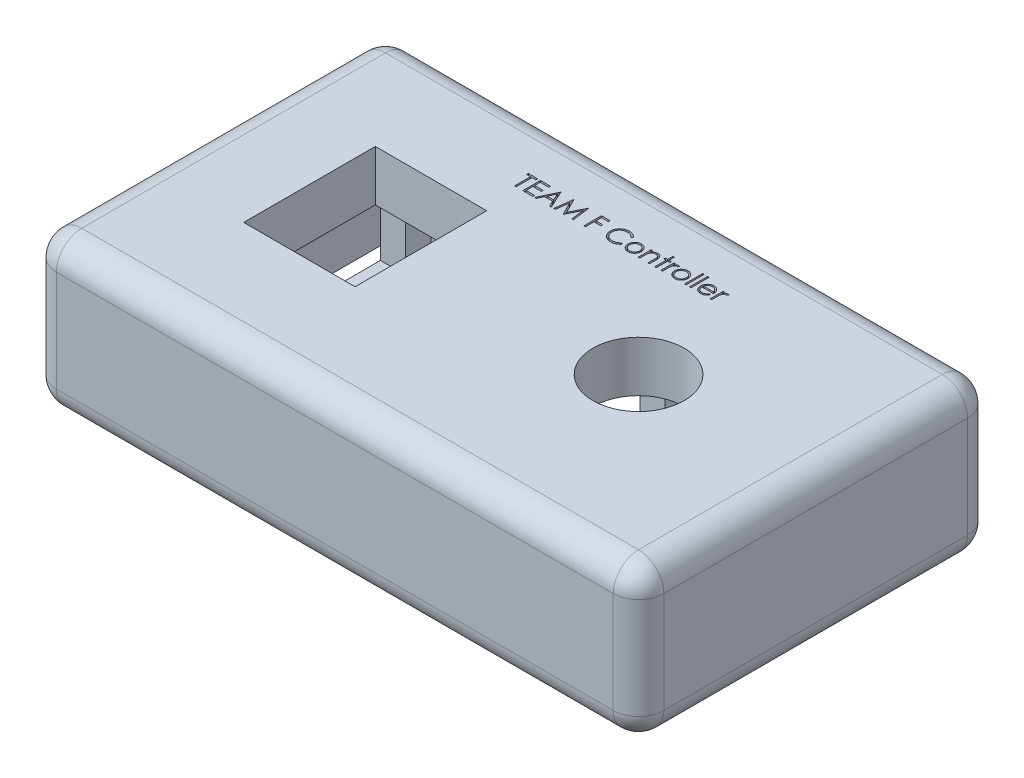
from build123d import *

# Parameters (mm, degrees)
SKETCH1_W           = 120
SKETCH1_H           = 70
BOSS_EXTRUDE1_DEPTH = 30
SKETCH2_R           = 9
SKETCH2_W           = 22
SKETCH2_H           = 26
CUT_EXTRUDE1_DEPTH  = 76.663729752
SKETCH4_W           = 21
SKETCH4_H           = 13
CUT_EXTRUDE3_DEPTH  = 10
SKETCH6_W           = 105
SKETCH6_H           = 55
CUT_EXTRUDE4_DEPTH  = 20
SKETCH8_W           = 5
SKETCH8_H           = 5
BOSS_EXTRUDE2_DEPTH = 10
SKETCH9_W           = 20
SKETCH9_H           = 30
SKETCH9_W_2         = 22
SKETCH9_H_2         = 38
BOSS_EXTRUDE3_DEPTH = 2.5
SKETCH11_W          = 10
SKETCH11_H          = 11.5
CUT_EXTRUDE5_DEPTH  = 5
SKETCH12_W          = 0.314102564
SKETCH12_H          = 3.58974359
SKETCH12_W_2        = 0.314102565
CUT_EXTRUDE6_DEPTH  = 1
FILLET1_R           = 5
CUT_EXTRUDE7_REACH  = 98.954
SKETCH14_W          = 15
SKETCH14_H          = 7.5
FILLET2_R           = 2


with BuildPart() as part:
    # Sketch1 → Boss-Extrude1 (new body)
    with BuildSketch(Plane(origin=(0, 0, 0), x_dir=(1, 0, 0), z_dir=(0, 1, 0))):
        Rectangle(SKETCH1_W, SKETCH1_H)
    extrude(amount=BOSS_EXTRUDE1_DEPTH)

    # Sketch2 → Cut-Extrude1 (cut, through all)
    with BuildSketch(Plane(origin=(0, 30, 0), x_dir=(1, 0, 0), z_dir=(0, 1, 0))):
        with Locations(Location((25, 0, 0), (0, 0, 270))):
            Circle(SKETCH2_R)
        with Locations((-29, 0)):
            Rectangle(SKETCH2_W, SKETCH2_H)
    extrude(amount=-CUT_EXTRUDE1_DEPTH, mode=Mode.SUBTRACT)

    # Sketch4 → Cut-Extrude3 (cut)
    with BuildSketch(Plane(origin=(0, 0, -35), x_dir=(-1, 0, 0), z_dir=(0, 0, -1))):
        with Locations((-39.5, 15)):
            Rectangle(SKETCH4_W, SKETCH4_H)
        with Locations((39.5, 15)):
            Rectangle(SKETCH4_W, SKETCH4_H)
    extrude(amount=-CUT_EXTRUDE3_DEPTH, mode=Mode.SUBTRACT)

    # Sketch6 → Cut-Extrude4 (cut)
    with BuildSketch(Plane.XZ):
        Rectangle(SKETCH6_W, SKETCH6_H)
    extrude(amount=-CUT_EXTRUDE4_DEPTH, mode=Mode.SUBTRACT)

    # Sketch8 → Boss-Extrude2 (add)
    with BuildSketch(Plane.XZ.offset(-20)):
        with Locations((32.5, -12.75)):
            Rectangle(SKETCH8_W, SKETCH8_H)
        with Locations((32.5, 12.25)):
            Rectangle(SKETCH8_W, SKETCH8_H)
        with Locations((17.5, 12.25)):
            Rectangle(SKETCH8_W, SKETCH8_H)
        with Locations((17.5, -12.75)):
            Rectangle(SKETCH8_W, SKETCH8_H)
        with Locations((-20.5, -16.5)):
            Rectangle(SKETCH8_W, SKETCH8_H)
        with Locations((-20.5, 16.5)):
            Rectangle(SKETCH8_W, SKETCH8_H)
        with Locations((-37.5, 16.5)):
            Rectangle(SKETCH8_W, SKETCH8_H)
        with Locations((-37.5, -16.5)):
            Rectangle(SKETCH8_W, SKETCH8_H)
    extrude(amount=BOSS_EXTRUDE2_DEPTH)

    # Sketch9 → Boss-Extrude3 (add)
    with BuildSketch(Plane(origin=(0, 10, 0), x_dir=(-1, 0, 0), z_dir=(0, -1, 0))):
        with Locations((-25, 0.25)):
            Rectangle(SKETCH9_W, SKETCH9_H)
        with Locations((29, 0)):
            Rectangle(SKETCH9_W_2, SKETCH9_H_2)
    extrude(amount=BOSS_EXTRUDE3_DEPTH)

    # Sketch11 → Cut-Extrude5 (cut)
    with BuildSketch(Plane.XY.offset(-27.5)):
        with Locations((-24, 14.25)):
            Rectangle(SKETCH11_W, SKETCH11_H)
        with Locations((24, 14.25)):
            Rectangle(SKETCH11_W, SKETCH11_H)
    extrude(amount=-CUT_EXTRUDE5_DEPTH, mode=Mode.SUBTRACT)

    # Sketch12 → Cut-Extrude6 (cut)
    # profile 1 of 15: a face of its own
    with BuildSketch(Plane(origin=(0, 30, 0), x_dir=(1, 0, 0), z_dir=(0, 1, 0))):
        Polygon((-20.259615385, 23.141025641), (-20.259615385, 23.5), (-18.419871795, 23.5), (-18.419871795, 23.141025641), (-19.182692308, 23.141025641), (-19.182692308, 20), (-19.496794872, 20), (-19.496794872, 23.141025641), align=None)
    # profile 2 of 15: a face of its own
    with BuildSketch(Plane(origin=(0, 30, 0), x_dir=(1, 0, 0), z_dir=(0, 1, 0))):
        Polygon((-17.881410256, 23.5), (-15.907051282, 23.5), (-15.907051282, 23.141025641), (-17.567307692, 23.141025641), (-17.567307692, 22.064102564), (-15.907051282, 22.064102564), (-15.907051282, 21.705128205), (-17.567307692, 21.705128205), (-17.567307692, 20.358974359), (-15.907051282, 20.358974359), (-15.907051282, 20), (-17.881410256, 20), align=None)
    # profile 3 of 15: a face of its own
    with BuildSketch(Plane(origin=(0, 30, 0), x_dir=(1, 0, 0), z_dir=(0, 1, 0))):
        Polygon((-13.842948718, 23.5), (-12.227564103, 20), (-12.569010417, 20), (-13.086438301, 21.121794872), (-14.673076923, 21.121794872), (-15.205228365, 20), (-15.548076923, 20), (-13.887820513, 23.5), align=None)
        Polygon((-13.868890224, 22.817808494), (-14.502704327, 21.480769231), (-13.251903045, 21.480769231), align=None, mode=Mode.SUBTRACT)
    # profile 4 of 15: a face of its own
    with BuildSketch(Plane(origin=(0, 30, 0), x_dir=(1, 0, 0), z_dir=(0, 1, 0))):
        Polygon((-11.778846154, 20), (-11.316806891, 23.5), (-11.271935096, 23.5), (-9.826923077, 20.628205128), (-8.385416667, 23.5), (-8.33984375, 23.5), (-7.875, 20), (-8.190504808, 20), (-8.525641026, 22.518429487), (-9.7890625, 20), (-9.859875801, 20), (-11.128205128, 22.524038462), (-11.462640224, 20), align=None)
    # profile 5 of 15: a face of its own
    with BuildSketch(Plane(origin=(0, 30, 0), x_dir=(1, 0, 0), z_dir=(0, 1, 0))):
        Polygon((-5.810897436, 23.5), (-4.105769231, 23.5), (-4.105769231, 23.141025641), (-5.496794872, 23.141025641), (-5.496794872, 22.064102564), (-4.105769231, 22.064102564), (-4.105769231, 21.705128205), (-5.496794872, 21.705128205), (-5.496794872, 20), (-5.810897436, 20), align=None)
    # profile 6 of 15: a face of its own
    with BuildSketch(Plane(origin=(0, 30, 0), x_dir=(1, 0, 0), z_dir=(0, 1, 0))):
        with BuildLine():
            Line((1.099358974, 22.857772436), (0.824519231, 22.647435897))
            add(Edge.make_bspline(
                [(0.824519231, 22.647435897), (0.804913342, 22.670801867), (0.765965896, 22.717218783), (0.703306693, 22.782398327), (0.63800505, 22.843463589), (0.570085929, 22.900705469), (0.498326809, 22.952122234), (0.424466011, 23.000393337), (0.347267966, 23.043661075), (0.240516231, 23.096124061), (0.100868383, 23.150870216), (-0.074926456, 23.196773448), (-0.258437555, 23.225994623), (-0.383635155, 23.229159465), (-0.447315705, 23.230769231)],
                knots=[0, 0, 0, 0, 0.757959112, 1.505699292, 2.245454638, 2.979532153, 3.711538275, 4.438200793, 5.171680507, 5.909471876, 7.393775596, 8.890124382, 10.418191784, 12, 12, 12, 12], degree=3))
            add(Edge.make_bspline(
                [(-0.447315705, 23.230769231), (-0.482399004, 23.230365268), (-0.552239997, 23.229561092), (-0.655888471, 23.218951967), (-0.757601522, 23.204040757), (-0.857312988, 23.181915434), (-0.954895946, 23.153942815), (-1.050988348, 23.120517401), (-1.144198948, 23.079162561), (-1.235817187, 23.033454301), (-1.323596398, 22.981826856), (-1.406651445, 22.925513504), (-1.484679413, 22.865144408), (-1.557742025, 22.800493302), (-1.625913974, 22.731851341), (-1.688701284, 22.658487), (-1.745886695, 22.580634826), (-1.79860372, 22.499321419), (-1.845816453, 22.414783627), (-1.885346333, 22.326708556), (-1.920351455, 22.236604453), (-1.948050697, 22.143453293), (-1.969975214, 22.047910527), (-1.985102878, 21.949719739), (-1.995591349, 21.849086059), (-1.996391526, 21.780876747), (-1.996794872, 21.746494391)],
                knots=[0, 0, 0, 0, 1.054917814, 2.100044995, 3.131103042, 4.146048494, 5.169673617, 6.183595914, 7.203665975, 8.234915748, 9.262203917, 10.264457458, 11.251630812, 12.227803204, 13.197192746, 14.159520551, 15.12972552, 16.100847026, 17.073214652, 18.039054194, 19.002613845, 19.979014051, 20.95965708, 21.949030935, 22.966165397, 24, 24, 24, 24], degree=3))
            add(Edge.make_bspline(
                [(-1.996794872, 21.746494391), (-1.995533053, 21.694763071), (-1.993055638, 21.593195486), (-1.971007304, 21.444424876), (-1.937502213, 21.301904202), (-1.887286636, 21.16652436), (-1.825367586, 21.036616002), (-1.747126974, 20.914377148), (-1.656510437, 20.797960584), (-1.552236017, 20.690117636), (-1.437830201, 20.591603911), (-1.31508229, 20.504853329), (-1.184298002, 20.432538447), (-1.046921372, 20.3723625), (-0.901895258, 20.326105772), (-0.749480455, 20.293541649), (-0.59000846, 20.272299468), (-0.48103906, 20.27026578), (-0.425580929, 20.269230769)],
                knots=[0, 0, 0, 0, 1.029171465, 2.020641659, 2.987623507, 3.938342917, 4.889210282, 5.84687017, 6.821220943, 7.821438502, 8.827599549, 9.822697543, 10.807740252, 11.797342354, 12.80366471, 13.83203677, 14.896651826, 16, 16, 16, 16], degree=3))
            add(Edge.make_bspline(
                [(-0.425580929, 20.269230769), (-0.36447824, 20.270919549), (-0.244213532, 20.274243472), (-0.067845505, 20.302402721), (0.10099026, 20.348060638), (0.262302847, 20.411958561), (0.415637493, 20.495023849), (0.561234153, 20.595721726), (0.699215724, 20.715010059), (0.782187006, 20.806093187), (0.824519231, 20.852564103)],
                knots=[0, 0, 0, 0, 1.028121516, 2.023589091, 2.998037872, 3.967518031, 4.937445131, 5.927275754, 6.942489185, 8, 8, 8, 8], degree=3))
            Line((0.824519231, 20.852564103), (1.099358974, 20.644330929))
            add(Edge.make_bspline(
                [(1.099358974, 20.644330929), (1.077240864, 20.615792478), (1.033110589, 20.558852271), (0.961652572, 20.478580562), (0.886375275, 20.403076526), (0.806719565, 20.332948905), (0.723601773, 20.266794439), (0.635529461, 20.206492608), (0.543660428, 20.151201724), (0.448305949, 20.100574799), (0.349567337, 20.055657552), (0.247562902, 20.017203784), (0.142732326, 19.984078895), (0.035070818, 19.956826958), (-0.075644939, 19.935555874), (-0.189015413, 19.921336199), (-0.305285288, 19.911594285), (-0.383726709, 19.910706369), (-0.423477564, 19.91025641)],
                knots=[0, 0, 0, 0, 0.986787822, 1.968848986, 2.935600012, 3.899624008, 4.868462664, 5.837806735, 6.815139263, 7.798259679, 8.787526145, 9.778297419, 10.776456485, 11.791383307, 12.812564526, 13.85620153, 14.913611965, 16, 16, 16, 16], degree=3))
            add(Edge.make_bspline(
                [(-0.423477564, 19.91025641), (-0.461121231, 19.910518403), (-0.535556921, 19.911036461), (-0.645455673, 19.919428628), (-0.752445254, 19.930878365), (-0.85621988, 19.948118496), (-0.957345855, 19.968462836), (-1.054906439, 19.995734093), (-1.149861649, 20.026283259), (-1.24182999, 20.062188246), (-1.33088969, 20.102704429), (-1.416753501, 20.148495987), (-1.499381934, 20.199177852), (-1.579587355, 20.253632863), (-1.656184938, 20.313610164), (-1.729838464, 20.378276799), (-1.80096094, 20.44741481), (-1.844963625, 20.497269663), (-1.86708734, 20.522335737)],
                knots=[0, 0, 0, 0, 1.114604814, 2.203992996, 3.262667896, 4.300477797, 5.318619304, 6.316056647, 7.298880507, 8.271930387, 9.238335007, 10.195173496, 11.151986948, 12.108099108, 13.064862484, 14.031167946, 15.010108607, 16, 16, 16, 16], degree=3))
            add(Edge.make_bspline(
                [(-1.86708734, 20.522335737), (-1.902522983, 20.565876926), (-1.97296646, 20.652433637), (-2.063092144, 20.792719618), (-2.140239699, 20.939187827), (-2.20261562, 21.092607755), (-2.251378353, 21.252635143), (-2.285159548, 21.419350657), (-2.307111152, 21.592598599), (-2.309621441, 21.710435388), (-2.310897436, 21.770332532)],
                knots=[0, 0, 0, 0, 0.994628077, 1.977248131, 2.950237994, 3.925870899, 4.908910175, 5.911660606, 6.938484602, 8, 8, 8, 8], degree=3))
            add(Edge.make_bspline(
                [(-2.310897436, 21.770332532), (-2.309342242, 21.833287986), (-2.306282496, 21.95714891), (-2.280286701, 22.138922863), (-2.238467904, 22.313074262), (-2.179071016, 22.479278007), (-2.103765665, 22.638408287), (-2.010739051, 22.789249492), (-1.901071908, 22.932766292), (-1.775624341, 23.066781043), (-1.638057005, 23.189320396), (-1.490738192, 23.297126599), (-1.333956245, 23.386844115), (-1.169438393, 23.461840278), (-0.995952711, 23.519484741), (-0.813869342, 23.559837928), (-0.623530427, 23.584955044), (-0.493668002, 23.588130252), (-0.427684295, 23.58974359)],
                knots=[0, 0, 0, 0, 1.032925535, 2.032216505, 3.007276963, 3.968222605, 4.92396291, 5.891752235, 6.871517503, 7.883894988, 8.900124299, 9.891468569, 10.874487609, 11.85992873, 12.854644235, 13.869047385, 14.917252991, 16, 16, 16, 16], degree=3))
            add(Edge.make_bspline(
                [(-0.427684295, 23.58974359), (-0.387469823, 23.589261452), (-0.307869326, 23.588307108), (-0.190116673, 23.579000965), (-0.075474346, 23.563487359), (0.036136636, 23.542371289), (0.145259252, 23.516163968), (0.251059493, 23.48202367), (0.35415818, 23.442987138), (0.453905088, 23.398028672), (0.549821638, 23.347561931), (0.641877957, 23.292146307), (0.729342815, 23.231850502), (0.812831664, 23.167187326), (0.890947875, 23.096788767), (0.965909353, 23.022591171), (1.035170431, 22.942457347), (1.077923626, 22.886052413), (1.099358974, 22.857772436)],
                knots=[0, 0, 0, 0, 1.096760587, 2.17092713, 3.219439832, 4.250915756, 5.268269357, 6.278326846, 7.281116186, 8.274029601, 9.260640565, 10.235837813, 11.203064059, 12.156899882, 13.114053108, 14.069676657, 15.032185724, 16, 16, 16, 16], degree=3))
        make_face()
    # profile 7 of 15: a face of its own
    with BuildSketch(Plane(origin=(0, 30, 0), x_dir=(1, 0, 0), z_dir=(0, 1, 0))):
        with BuildLine():
            add(Edge.make_bspline(
                [(2.962940705, 22.602564103), (3.010931978, 22.601542211), (3.105031136, 22.599538533), (3.242839021, 22.578123567), (3.374384157, 22.545376203), (3.50017035, 22.500104641), (3.618586645, 22.43942269), (3.731357889, 22.367013399), (3.838174898, 22.281230805), (3.902197927, 22.214872737), (3.934695513, 22.181189904)],
                knots=[0, 0, 0, 0, 1.054011418, 2.066658804, 3.057071809, 4.030435133, 4.997543892, 5.974964718, 6.972108034, 8, 8, 8, 8], degree=3))
            add(Edge.make_bspline(
                [(3.934695513, 22.181189904), (3.962677467, 22.148975918), (4.018099847, 22.085171376), (4.089165566, 21.981715763), (4.150387126, 21.874575662), (4.199450087, 21.762328336), (4.238135111, 21.645953664), (4.265600807, 21.525051653), (4.281937742, 21.399889306), (4.284140709, 21.314885468), (4.28525641, 21.271834936)],
                knots=[0, 0, 0, 0, 1.025258237, 2.030674902, 3.01204498, 3.988269485, 4.97094183, 5.956517959, 6.965070386, 8, 8, 8, 8], degree=3))
            add(Edge.make_bspline(
                [(4.28525641, 21.271834936), (4.284275073, 21.228534878), (4.282335905, 21.142971945), (4.263992288, 21.016952579), (4.235461202, 20.894757756), (4.194629364, 20.776899063), (4.142271255, 20.663016235), (4.078380567, 20.553606686), (4.00250895, 20.448454553), (3.916504953, 20.348452714), (3.821453077, 20.2562865), (3.718336929, 20.17595823), (3.609182895, 20.107136706), (3.492539542, 20.05170029), (3.369472055, 20.00799059), (3.239714987, 19.977290573), (3.103469917, 19.95872889), (3.010442695, 19.956345316), (2.962940705, 19.955128205)],
                knots=[0, 0, 0, 0, 0.998656419, 1.973391657, 2.932242238, 3.890759089, 4.846373663, 5.82037756, 6.809684879, 7.83454468, 8.860553229, 9.859544525, 10.845671541, 11.83227036, 12.833544569, 13.85385346, 14.904124723, 16, 16, 16, 16], degree=3))
            add(Edge.make_bspline(
                [(2.962940705, 19.955128205), (2.915205986, 19.956349401), (2.821715126, 19.958741176), (2.684989144, 19.977218459), (2.554999525, 20.007976441), (2.431770927, 20.051843934), (2.31462608, 20.107138478), (2.204839583, 20.175750167), (2.101639667, 20.256310322), (2.006567683, 20.348446259), (1.920569077, 20.448456216), (1.844696069, 20.553606254), (1.780805743, 20.663016348), (1.728447539, 20.776899033), (1.687615726, 20.894757764), (1.659084633, 21.016952577), (1.640741019, 21.142971945), (1.63880185, 21.228534878), (1.637820513, 21.271834936)],
                knots=[0, 0, 0, 0, 1.099876186, 2.154163076, 3.173186993, 4.173200201, 5.163417411, 6.152872554, 7.150605724, 8.17532212, 9.198891216, 10.186952605, 11.159729845, 12.11414092, 13.071450619, 14.029093627, 15.002601286, 16, 16, 16, 16], degree=3))
            add(Edge.make_bspline(
                [(1.637820513, 21.271834936), (1.638943823, 21.314651482), (1.641167785, 21.399420884), (1.657488294, 21.524347945), (1.68484685, 21.645045334), (1.723578247, 21.76097081), (1.773093438, 21.872726246), (1.833454725, 21.980131077), (1.905245358, 22.083118877), (1.96044731, 22.146840957), (1.98838141, 22.179086538)],
                knots=[0, 0, 0, 0, 1.031353054, 2.041901799, 3.029428768, 4.008703097, 4.981709435, 5.96992636, 6.972712378, 8, 8, 8, 8], degree=3))
            add(Edge.make_bspline(
                [(1.98838141, 22.179086538), (2.020830001, 22.213061478), (2.084645865, 22.279879174), (2.191994593, 22.365411698), (2.304488414, 22.439327772), (2.42421334, 22.498803987), (2.549896198, 22.545642505), (2.682115441, 22.57820802), (2.820390956, 22.599461375), (2.914950577, 22.601519553), (2.962940705, 22.602564103)],
                knots=[0, 0, 0, 0, 1.027980169, 2.021703884, 2.998553061, 3.971491411, 4.943284454, 5.930300938, 6.949603206, 8, 8, 8, 8], degree=3))
        make_face()
        with BuildLine():
            add(Edge.make_bspline(
                [(2.961538462, 22.288461538), (2.92760085, 22.287496947), (2.860601722, 22.285592664), (2.761982137, 22.27110876), (2.667041983, 22.248161255), (2.575601139, 22.215557199), (2.487967966, 22.1734583), (2.404058564, 22.12174994), (2.323626124, 22.061116984), (2.248244061, 21.991654312), (2.179061749, 21.915775317), (2.118583772, 21.834926959), (2.067158666, 21.750420612), (2.024318507, 21.662168401), (1.992411319, 21.569275987), (1.969238296, 21.472795356), (1.954768056, 21.37252994), (1.952881677, 21.304368921), (1.951923077, 21.269731571)],
                knots=[0, 0, 0, 0, 1.021534396, 2.016698045, 2.994645724, 3.958388632, 4.93408049, 5.916473867, 6.921342795, 7.962252576, 8.998418191, 10.008913653, 10.997312074, 11.973003931, 12.956656626, 13.948281152, 14.957379055, 16, 16, 16, 16], degree=3))
            add(Edge.make_bspline(
                [(1.951923077, 21.269731571), (1.953529901, 21.224979543), (1.956719145, 21.136155138), (1.982654381, 21.005344015), (2.026040661, 20.879762163), (2.084627941, 20.760145777), (2.15803416, 20.649473499), (2.244521226, 20.550802015), (2.343160927, 20.465616203), (2.452777427, 20.394935358), (2.571131745, 20.338775602), (2.696388066, 20.298976626), (2.82702876, 20.273104934), (2.916309491, 20.270533459), (2.961538462, 20.269230769)],
                knots=[0, 0, 0, 0, 1.016792936, 2.018143844, 3.017858371, 4.030088057, 5.03801393, 6.028138512, 7.003788237, 7.991172063, 8.984598303, 9.972568034, 10.972917682, 12, 12, 12, 12], degree=3))
            add(Edge.make_bspline(
                [(2.961538462, 20.269230769), (3.00676483, 20.270541049), (3.096040426, 20.273127506), (3.226499603, 20.298846326), (3.351413575, 20.338949987), (3.469644963, 20.394872197), (3.579211566, 20.465884611), (3.678560687, 20.550320988), (3.764309299, 20.64973484), (3.837642903, 20.760292369), (3.897189646, 20.879576721), (3.940372848, 21.005367193), (3.966370434, 21.136149235), (3.969551263, 21.224977566), (3.971153846, 21.269731571)],
                knots=[0, 0, 0, 0, 1.02726834, 2.027799167, 3.010890988, 4.004497153, 4.992059811, 5.971914811, 6.958719428, 7.966827853, 8.981595046, 9.981490638, 10.983022906, 12, 12, 12, 12], degree=3))
            add(Edge.make_bspline(
                [(3.971153846, 21.269731571), (3.970195576, 21.304369128), (3.968309847, 21.372530554), (3.953834883, 21.472793007), (3.930679343, 21.569284604), (3.898707726, 21.662136607), (3.856053712, 21.750649112), (3.803636919, 21.834678839), (3.743405893, 21.916055385), (3.673388772, 21.991409026), (3.598085395, 22.061144062), (3.517620356, 22.121773452), (3.433835378, 22.173231047), (3.346456795, 22.215917288), (3.255004228, 22.247864628), (3.160197098, 22.271241259), (3.061998288, 22.285531456), (2.995239245, 22.287478598), (2.961538462, 22.288461538)],
                knots=[0, 0, 0, 0, 1.042956736, 2.052379634, 3.044323526, 4.02829302, 5.004299113, 5.996692471, 7.007513377, 8.048758398, 9.090003419, 10.095195979, 11.07790575, 12.047570684, 13.018257071, 13.989683339, 14.985167495, 16, 16, 16, 16], degree=3))
        make_face(mode=Mode.SUBTRACT)
    # profile 8 of 15: a face of its own
    with BuildSketch(Plane(origin=(0, 30, 0), x_dir=(1, 0, 0), z_dir=(0, 1, 0))):
        with BuildLine():
            Line((4.913461538, 22.557692308), (5.227564103, 22.557692308))
            Line((5.227564103, 22.557692308), (5.227564103, 22.096354167))
            add(Edge.make_bspline(
                [(5.227564103, 22.096354167), (5.261101738, 22.13819689), (5.326182689, 22.219394153), (5.434567022, 22.326114728), (5.549110922, 22.414059953), (5.669112926, 22.484163747), (5.794735936, 22.537010373), (5.925214206, 22.575176304), (6.061328912, 22.598061132), (6.153893349, 22.601051363), (6.200721154, 22.602564103)],
                knots=[0, 0, 0, 0, 1.12780773, 2.188550248, 3.19190651, 4.159438251, 5.104880172, 6.052711206, 7.014878035, 8, 8, 8, 8], degree=3))
            add(Edge.make_bspline(
                [(6.200721154, 22.602564103), (6.248051788, 22.600818907), (6.340689256, 22.597403139), (6.475567317, 22.570386448), (6.601540711, 22.524241192), (6.718160267, 22.461029122), (6.82328748, 22.382422649), (6.915612331, 22.290844867), (6.991975579, 22.185508784), (7.043172942, 22.087785627), (7.076898589, 22.001096833), (7.098130927, 21.926850083), (7.116161908, 21.844131932), (7.131793656, 21.753192343), (7.142370768, 21.653394153), (7.15071306, 21.545146461), (7.156691754, 21.42848433), (7.156928961, 21.347797703), (7.157051282, 21.306189904)],
                knots=[0, 0, 0, 0, 1.235846778, 2.418850247, 3.575807741, 4.728682307, 5.871620074, 6.994088408, 8.11269785, 9.256955736, 9.865816715, 10.540099792, 11.271859618, 12.076849838, 12.949306005, 13.892391288, 14.913166135, 16, 16, 16, 16], degree=3))
            Line((7.157051282, 21.306189904), (7.157051282, 20))
            Line((7.157051282, 20), (6.842948718, 20))
            Line((6.842948718, 20), (6.842948718, 21.203125))
            add(Edge.make_bspline(
                [(6.842948718, 21.203125), (6.84275551, 21.237947445), (6.842385936, 21.304556856), (6.841220289, 21.399925879), (6.838410483, 21.486412457), (6.83446217, 21.563809825), (6.828683139, 21.632043661), (6.822660508, 21.691252938), (6.815295531, 21.74136248), (6.808732618, 21.771527563), (6.805789263, 21.78505609)],
                knots=[0, 0, 0, 0, 1.430800155, 2.736877192, 3.918605307, 4.986035426, 5.920637409, 6.731861385, 7.431261377, 8, 8, 8, 8], degree=3))
            add(Edge.make_bspline(
                [(6.805789263, 21.78505609), (6.795163731, 21.824767275), (6.774712871, 21.901199019), (6.724178888, 22.004873372), (6.660364707, 22.09307156), (6.582466857, 22.165248281), (6.491237782, 22.221419118), (6.386930639, 22.260393073), (6.270551998, 22.284769342), (6.188697616, 22.287196474), (6.146033654, 22.288461538)],
                knots=[0, 0, 0, 0, 1.084156227, 2.086665306, 3.027808233, 3.945421172, 4.874247719, 5.839848303, 6.874090471, 8, 8, 8, 8], degree=3))
            add(Edge.make_bspline(
                [(6.146033654, 22.288461538), (6.12076597, 22.287985534), (6.070761877, 22.287043533), (5.996611905, 22.277592235), (5.924687732, 22.262133779), (5.854267523, 22.241265142), (5.786759729, 22.212602873), (5.719995438, 22.180073502), (5.656488674, 22.13952529), (5.594885277, 22.094334669), (5.537572469, 22.044255462), (5.484244131, 21.991410952), (5.436706111, 21.935135348), (5.393637435, 21.8763354), (5.356459172, 21.814203562), (5.324006084, 21.749339256), (5.296470389, 21.681657107), (5.282787697, 21.634682046), (5.275941506, 21.611177885)],
                knots=[0, 0, 0, 0, 1.023777757, 2.026029729, 3.023749952, 4.003683103, 4.997618607, 5.993177895, 7.010360494, 8.046726602, 9.087585522, 10.09234134, 11.086953743, 12.070360549, 13.043493632, 14.017870808, 15.008233677, 16, 16, 16, 16], degree=3))
            add(Edge.make_bspline(
                [(5.275941506, 21.611177885), (5.272001858, 21.593922682), (5.263425449, 21.556359007), (5.254162269, 21.494714588), (5.245754694, 21.423404613), (5.238717735, 21.342512296), (5.234412319, 21.251754421), (5.229717922, 21.151518583), (5.228008861, 21.041405094), (5.227716507, 20.964743402), (5.227564103, 20.924779647)],
                knots=[0, 0, 0, 0, 0.615963638, 1.340920617, 2.168419149, 3.115676021, 4.16674242, 5.331190069, 6.6087489, 8, 8, 8, 8], degree=3))
            Line((5.227564103, 20.924779647), (5.227564103, 20))
            Line((5.227564103, 20), (4.913461538, 20))
            Line((4.913461538, 20), (4.913461538, 22.557692308))
        make_face()
    # profile 9 of 15: a face of its own
    with BuildSketch(Plane(origin=(0, 30, 0), x_dir=(1, 0, 0), z_dir=(0, 1, 0))):
        Polygon((8.189102564, 23.58974359), (8.503205128, 23.58974359), (8.503205128, 22.557692308), (8.951923077, 22.557692308), (8.951923077, 22.243589744), (8.503205128, 22.243589744), (8.503205128, 20), (8.189102564, 20), (8.189102564, 22.243589744), (7.740384615, 22.243589744), (7.740384615, 22.557692308), (8.189102564, 22.557692308), align=None)
    # profile 10 of 15: a face of its own
    with BuildSketch(Plane(origin=(0, 30, 0), x_dir=(1, 0, 0), z_dir=(0, 1, 0))):
        with BuildLine():
            Line((9.400641026, 22.557692308), (9.71474359, 22.557692308))
            Line((9.71474359, 22.557692308), (9.71474359, 22.181189904))
            add(Edge.make_bspline(
                [(9.71474359, 22.181189904), (9.737932348, 22.216245732), (9.782280669, 22.283289731), (9.855993599, 22.371959032), (9.93149693, 22.445374079), (10.009152117, 22.503877598), (10.089530217, 22.547690717), (10.170867169, 22.579783752), (10.254442639, 22.598761067), (10.310604563, 22.601294726), (10.338741987, 22.602564103)],
                knots=[0, 0, 0, 0, 1.2804753, 2.448899062, 3.506932113, 4.484331642, 5.4025378, 6.288909075, 7.142734305, 8, 8, 8, 8], degree=3))
            add(Edge.make_bspline(
                [(10.338741987, 22.602564103), (10.360568314, 22.601373576), (10.405477399, 22.59892399), (10.473459989, 22.581713165), (10.543503441, 22.554235143), (10.588645828, 22.52839492), (10.612179487, 22.514923878)],
                knots=[0, 0, 0, 0, 0.901110191, 1.854092781, 2.881294221, 4, 4, 4, 4], degree=3))
            Line((10.612179487, 22.514923878), (10.439703526, 22.242888622))
            add(Edge.make_bspline(
                [(10.439703526, 22.242888622), (10.424594504, 22.249628888), (10.39591469, 22.262423203), (10.353960124, 22.277565213), (10.315278787, 22.286481129), (10.290635229, 22.287831847), (10.279146635, 22.288461538)],
                knots=[0, 0, 0, 0, 1.180555205, 2.24091978, 3.179933427, 4, 4, 4, 4], degree=3))
            add(Edge.make_bspline(
                [(10.279146635, 22.288461538), (10.253940901, 22.286781501), (10.202528511, 22.283354712), (10.127044012, 22.256415904), (10.053796806, 22.212890664), (9.995625144, 22.164619552), (9.950582891, 22.118071755), (9.918442665, 22.077423352), (9.888959919, 22.031844721), (9.860789698, 21.982115037), (9.835123404, 21.927385191), (9.811168735, 21.868201977), (9.789509872, 21.804496849), (9.777159628, 21.760114328), (9.770833333, 21.737379808)],
                knots=[0, 0, 0, 0, 1.125678352, 2.296057538, 3.5422874, 4.923748041, 5.663163013, 6.437101912, 7.23742474, 8.08941207, 8.991984279, 9.93940061, 10.944477711, 12, 12, 12, 12], degree=3))
            add(Edge.make_bspline(
                [(9.770833333, 21.737379808), (9.76610094, 21.717102634), (9.755619048, 21.672190235), (9.74542751, 21.596841711), (9.735357992, 21.507818052), (9.728261374, 21.404871459), (9.721683332, 21.288259015), (9.71797325, 21.15780307), (9.714870109, 21.013369718), (9.714787042, 20.912395365), (9.71474359, 20.859575321)],
                knots=[0, 0, 0, 0, 0.566838948, 1.255505196, 2.06880316, 3.007127437, 4.065329342, 5.249902469, 6.561414163, 8, 8, 8, 8], degree=3))
            Line((9.71474359, 20.859575321), (9.71474359, 20))
            Line((9.71474359, 20), (9.400641026, 20))
            Line((9.400641026, 20), (9.400641026, 22.557692308))
        make_face()
    # profile 11 of 15: a face of its own
    with BuildSketch(Plane(origin=(0, 30, 0), x_dir=(1, 0, 0), z_dir=(0, 1, 0))):
        with BuildLine():
            add(Edge.make_bspline(
                [(12.161658654, 22.602564103), (12.209649927, 22.601542211), (12.303749084, 22.599538533), (12.44155697, 22.578123567), (12.573102106, 22.545376203), (12.698888298, 22.500104641), (12.817304594, 22.43942269), (12.930075838, 22.367013399), (13.036892847, 22.281230805), (13.100915876, 22.214872737), (13.133413462, 22.181189904)],
                knots=[0, 0, 0, 0, 1.054011418, 2.066658804, 3.057071809, 4.030435133, 4.997543892, 5.974964718, 6.972108034, 8, 8, 8, 8], degree=3))
            add(Edge.make_bspline(
                [(13.133413462, 22.181189904), (13.161395416, 22.148975918), (13.216817796, 22.085171376), (13.287883515, 21.981715763), (13.349105075, 21.874575662), (13.398168036, 21.762328336), (13.436853059, 21.645953664), (13.464318756, 21.525051653), (13.480655691, 21.399889306), (13.482858658, 21.314885468), (13.483974359, 21.271834936)],
                knots=[0, 0, 0, 0, 1.025258237, 2.030674902, 3.01204498, 3.988269485, 4.97094183, 5.956517959, 6.965070386, 8, 8, 8, 8], degree=3))
            add(Edge.make_bspline(
                [(13.483974359, 21.271834936), (13.482993022, 21.228534878), (13.481053853, 21.142971945), (13.462710237, 21.016952579), (13.434179151, 20.894757756), (13.393347313, 20.776899063), (13.340989204, 20.663016235), (13.277098516, 20.553606686), (13.201226899, 20.448454553), (13.115222902, 20.348452714), (13.020171026, 20.2562865), (12.917054878, 20.17595823), (12.807900844, 20.107136706), (12.691257491, 20.05170029), (12.568190004, 20.00799059), (12.438432936, 19.977290573), (12.302187865, 19.95872889), (12.209160644, 19.956345316), (12.161658654, 19.955128205)],
                knots=[0, 0, 0, 0, 0.998656419, 1.973391657, 2.932242238, 3.890759089, 4.846373663, 5.82037756, 6.809684879, 7.83454468, 8.860553229, 9.859544525, 10.845671541, 11.83227036, 12.833544569, 13.85385346, 14.904124723, 16, 16, 16, 16], degree=3))
            add(Edge.make_bspline(
                [(12.161658654, 19.955128205), (12.113923934, 19.956349401), (12.020433075, 19.958741176), (11.883707093, 19.977218459), (11.753717474, 20.007976441), (11.630488875, 20.051843934), (11.513344028, 20.107138478), (11.403557531, 20.175750167), (11.300357616, 20.256310322), (11.205285631, 20.348446259), (11.119287026, 20.448456216), (11.043414018, 20.553606254), (10.979523692, 20.663016348), (10.927165488, 20.776899033), (10.886333675, 20.894757764), (10.857802582, 21.016952577), (10.839458968, 21.142971945), (10.837519799, 21.228534878), (10.836538462, 21.271834936)],
                knots=[0, 0, 0, 0, 1.099876186, 2.154163076, 3.173186993, 4.173200201, 5.163417411, 6.152872554, 7.150605724, 8.17532212, 9.198891216, 10.186952605, 11.159729845, 12.11414092, 13.071450619, 14.029093627, 15.002601286, 16, 16, 16, 16], degree=3))
            add(Edge.make_bspline(
                [(10.836538462, 21.271834936), (10.837661772, 21.314651482), (10.839885733, 21.399420884), (10.856206242, 21.524347945), (10.883564799, 21.645045334), (10.922296195, 21.76097081), (10.971811386, 21.872726246), (11.032172674, 21.980131077), (11.103963307, 22.083118877), (11.159165258, 22.146840957), (11.187099359, 22.179086538)],
                knots=[0, 0, 0, 0, 1.031353054, 2.041901799, 3.029428768, 4.008703097, 4.981709435, 5.96992636, 6.972712378, 8, 8, 8, 8], degree=3))
            add(Edge.make_bspline(
                [(11.187099359, 22.179086538), (11.21954795, 22.213061478), (11.283363814, 22.279879174), (11.390712542, 22.365411698), (11.503206363, 22.439327772), (11.622931289, 22.498803987), (11.748614147, 22.545642505), (11.880833389, 22.57820802), (12.019108905, 22.599461375), (12.113668526, 22.601519553), (12.161658654, 22.602564103)],
                knots=[0, 0, 0, 0, 1.027980169, 2.021703884, 2.998553061, 3.971491411, 4.943284454, 5.930300938, 6.949603206, 8, 8, 8, 8], degree=3))
        make_face()
        with BuildLine():
            add(Edge.make_bspline(
                [(12.16025641, 22.288461538), (12.126318799, 22.287496947), (12.05931967, 22.285592664), (11.960700086, 22.27110876), (11.865759932, 22.248161255), (11.774319087, 22.215557199), (11.686685915, 22.1734583), (11.602776513, 22.12174994), (11.522344073, 22.061116984), (11.446962009, 21.991654312), (11.377779697, 21.915775317), (11.317301721, 21.834926959), (11.265876614, 21.750420612), (11.223036455, 21.662168401), (11.191129267, 21.569275987), (11.167956245, 21.472795356), (11.153486004, 21.37252994), (11.151599626, 21.304368921), (11.150641026, 21.269731571)],
                knots=[0, 0, 0, 0, 1.021534396, 2.016698045, 2.994645724, 3.958388632, 4.93408049, 5.916473867, 6.921342795, 7.962252576, 8.998418191, 10.008913653, 10.997312074, 11.973003931, 12.956656626, 13.948281152, 14.957379055, 16, 16, 16, 16], degree=3))
            add(Edge.make_bspline(
                [(11.150641026, 21.269731571), (11.152247849, 21.224979543), (11.155437094, 21.136155138), (11.18137233, 21.005344015), (11.22475861, 20.879762163), (11.28334589, 20.760145777), (11.356752108, 20.649473499), (11.443239175, 20.550802015), (11.541878875, 20.465616203), (11.651495376, 20.394935358), (11.769849694, 20.338775602), (11.895106015, 20.298976626), (12.025746709, 20.273104934), (12.11502744, 20.270533459), (12.16025641, 20.269230769)],
                knots=[0, 0, 0, 0, 1.016792936, 2.018143844, 3.017858371, 4.030088057, 5.03801393, 6.028138512, 7.003788237, 7.991172063, 8.984598303, 9.972568034, 10.972917682, 12, 12, 12, 12], degree=3))
            add(Edge.make_bspline(
                [(12.16025641, 20.269230769), (12.205482779, 20.270541049), (12.294758375, 20.273127506), (12.425217552, 20.298846326), (12.550131524, 20.338949987), (12.668362911, 20.394872197), (12.777929515, 20.465884611), (12.877278636, 20.550320988), (12.963027247, 20.64973484), (13.036360852, 20.760292369), (13.095907595, 20.879576721), (13.139090797, 21.005367193), (13.165088383, 21.136149235), (13.168269211, 21.224977566), (13.169871795, 21.269731571)],
                knots=[0, 0, 0, 0, 1.02726834, 2.027799167, 3.010890988, 4.004497153, 4.992059811, 5.971914811, 6.958719428, 7.966827853, 8.981595046, 9.981490638, 10.983022906, 12, 12, 12, 12], degree=3))
            add(Edge.make_bspline(
                [(13.169871795, 21.269731571), (13.168913525, 21.304369128), (13.167027796, 21.372530554), (13.152552831, 21.472793007), (13.129397292, 21.569284604), (13.097425674, 21.662136607), (13.054771661, 21.750649112), (13.002354868, 21.834678839), (12.942123842, 21.916055385), (12.872106721, 21.991409026), (12.796803343, 22.061144062), (12.716338305, 22.121773452), (12.632553327, 22.173231047), (12.545174744, 22.215917288), (12.453722176, 22.247864628), (12.358915047, 22.271241259), (12.260716237, 22.285531456), (12.193957194, 22.287478598), (12.16025641, 22.288461538)],
                knots=[0, 0, 0, 0, 1.042956736, 2.052379634, 3.044323526, 4.02829302, 5.004299113, 5.996692471, 7.007513377, 8.048758398, 9.090003419, 10.095195979, 11.07790575, 12.047570684, 13.018257071, 13.989683339, 14.985167495, 16, 16, 16, 16], degree=3))
        make_face(mode=Mode.SUBTRACT)
    # profile 12 of 15: a face of its own
    with BuildSketch(Plane(origin=(0, 30, 0), x_dir=(1, 0, 0), z_dir=(0, 1, 0))):
        with Locations((14.224358974, 21.794871795)):
            Rectangle(SKETCH12_W, SKETCH12_H)
    # profile 13 of 15: a face of its own
    with BuildSketch(Plane(origin=(0, 30, 0), x_dir=(1, 0, 0), z_dir=(0, 1, 0))):
        with Locations((15.211538462, 21.794871795)):
            Rectangle(SKETCH12_W_2, SKETCH12_H)
    # profile 14 of 15: a face of its own
    with BuildSketch(Plane(origin=(0, 30, 0), x_dir=(1, 0, 0), z_dir=(0, 1, 0))):
        with BuildLine():
            Line((18.185697115, 20.807692308), (18.46474359, 20.661157853))
            add(Edge.make_bspline(
                [(18.46474359, 20.661157853), (18.442506995, 20.621714521), (18.399243386, 20.544973418), (18.324842638, 20.439541558), (18.246850566, 20.344693842), (18.161746598, 20.262964188), (18.072076919, 20.191712803), (17.977344264, 20.129374978), (17.877055446, 20.076256458), (17.771205721, 20.03150393), (17.65890617, 19.997094436), (17.539884654, 19.972790215), (17.413913158, 19.957766946), (17.327566978, 19.956021806), (17.283353365, 19.955128205)],
                knots=[0, 0, 0, 0, 1.120438281, 2.179929193, 3.190490725, 4.156257408, 5.095198341, 6.022838206, 6.959905092, 7.901321166, 8.864066838, 9.862729781, 10.905609505, 12, 12, 12, 12], degree=3))
            add(Edge.make_bspline(
                [(17.283353365, 19.955128205), (17.234211388, 19.95627538), (17.138349626, 19.958513187), (16.998809879, 19.977805652), (16.867430461, 20.00927801), (16.744218757, 20.053243552), (16.629476505, 20.110670876), (16.52297565, 20.180630358), (16.424156124, 20.262762612), (16.336131915, 20.357779056), (16.256888032, 20.459461013), (16.186962212, 20.565416898), (16.128504781, 20.675380122), (16.080952171, 20.788650646), (16.042547306, 20.90451454), (16.015780602, 21.024026007), (16.000350854, 21.146861592), (15.997986409, 21.229958927), (15.996794872, 21.271834936)],
                knots=[0, 0, 0, 0, 1.145258523, 2.234067595, 3.276747158, 4.290159414, 5.277019952, 6.260822364, 7.254936242, 8.264827045, 9.274100331, 10.257902744, 11.220704747, 12.172965371, 13.118907548, 14.062713208, 15.023725156, 16, 16, 16, 16], degree=3))
            add(Edge.make_bspline(
                [(15.996794872, 21.271834936), (15.997854013, 21.311129766), (15.999953091, 21.389006931), (16.013183879, 21.504272476), (16.036632172, 21.616300928), (16.068808496, 21.725185376), (16.110359742, 21.83074351), (16.161191961, 21.933039574), (16.221384339, 22.031964713), (16.267857013, 22.094367847), (16.291266026, 22.125801282)],
                knots=[0, 0, 0, 0, 1.024358464, 2.0301432, 3.019427413, 4.004406732, 4.986367066, 5.972626655, 6.978780325, 8, 8, 8, 8], degree=3))
            add(Edge.make_bspline(
                [(16.291266026, 22.125801282), (16.322973708, 22.163670152), (16.385384655, 22.238208303), (16.49094101, 22.336146628), (16.605241207, 22.418190404), (16.726852833, 22.48619754), (16.857189307, 22.537871187), (16.994498598, 22.576378769), (17.140344184, 22.59795678), (17.240049405, 22.601004614), (17.291065705, 22.602564103)],
                knots=[0, 0, 0, 0, 1.030682036, 2.02871468, 2.997146059, 3.962720338, 4.930598197, 5.918074684, 6.934738563, 8, 8, 8, 8], degree=3))
            add(Edge.make_bspline(
                [(17.291065705, 22.602564103), (17.34351331, 22.601210054), (17.446403556, 22.598553718), (17.596435677, 22.573927385), (17.738396394, 22.53487483), (17.872228898, 22.47972104), (17.997946759, 22.408561488), (18.114732809, 22.320419647), (18.224584321, 22.218001559), (18.2884929, 22.13923835), (18.321013622, 22.099158654)],
                knots=[0, 0, 0, 0, 1.056321875, 2.072262726, 3.055038591, 4.01806755, 4.982017516, 5.957941055, 6.960871419, 8, 8, 8, 8], degree=3))
            add(Edge.make_bspline(
                [(18.321013622, 22.099158654), (18.34314056, 22.068955072), (18.387247153, 22.008748954), (18.442494253, 21.910577797), (18.490451648, 21.807867202), (18.528784609, 21.698956905), (18.55982411, 21.585137325), (18.582280929, 21.46559478), (18.595450548, 21.340364869), (18.598039245, 21.255038314), (18.599358974, 21.211538462)],
                knots=[0, 0, 0, 0, 0.94817472, 1.890038105, 2.849395472, 3.817997239, 4.812318967, 5.836947057, 6.897266129, 8, 8, 8, 8], degree=3))
            Line((18.599358974, 21.211538462), (16.310897436, 21.211538462))
            add(Edge.make_bspline(
                [(16.310897436, 21.211538462), (16.312437042, 21.177837997), (16.315464616, 21.111567394), (16.329579759, 21.01459661), (16.351828533, 20.922223268), (16.383097596, 20.835140226), (16.420964441, 20.752210099), (16.467350158, 20.674048062), (16.522689712, 20.601010132), (16.584415411, 20.532442994), (16.653122507, 20.471382233), (16.725405254, 20.416730457), (16.802298819, 20.37092486), (16.883196902, 20.33374497), (16.967968687, 20.304638654), (17.056640883, 20.284770834), (17.149038999, 20.271463727), (17.212024733, 20.269984061), (17.244090545, 20.269230769)],
                knots=[0, 0, 0, 0, 1.094153842, 2.151609401, 3.174256925, 4.172055639, 5.149267565, 6.128595816, 7.11444997, 8.118368179, 9.117203808, 10.09244225, 11.054858984, 12.015122123, 12.976791628, 13.957293641, 14.960065497, 16, 16, 16, 16], degree=3))
            add(Edge.make_bspline(
                [(17.244090545, 20.269230769), (17.275441692, 20.269838826), (17.337648383, 20.271045327), (17.430289241, 20.282777238), (17.521428768, 20.301747513), (17.610689751, 20.327637504), (17.696260597, 20.359214356), (17.775506147, 20.397317213), (17.848386363, 20.43946696), (17.91650333, 20.487676635), (17.982574323, 20.546684822), (18.048116809, 20.620320543), (18.118393463, 20.707408071), (18.162383055, 20.772953737), (18.185697115, 20.807692308)],
                knots=[0, 0, 0, 0, 0.99110716, 1.966546729, 2.947904876, 3.932708344, 4.903319531, 5.828989031, 6.710028674, 7.56322171, 8.463672341, 9.504779593, 10.677557249, 12, 12, 12, 12], degree=3))
        make_face()
        with BuildLine():
            add(Edge.make_bspline(
                [(18.28525641, 21.525641026), (18.273759786, 21.567303899), (18.251632484, 21.64749152), (18.20539612, 21.75853241), (18.153324579, 21.857220311), (18.091702848, 21.942799944), (18.021884122, 22.018803457), (17.941238939, 22.085222043), (17.850803046, 22.144639494), (17.751043905, 22.194791993), (17.64540212, 22.237481852), (17.534795928, 22.266106968), (17.42193814, 22.28571651), (17.345603854, 22.287542618), (17.307191506, 22.288461538)],
                knots=[0, 0, 0, 0, 1.154881502, 2.222775134, 3.210006277, 4.132804581, 5.035138423, 5.962687519, 6.919655026, 7.923214229, 8.944639381, 9.960483929, 10.97369054, 12, 12, 12, 12], degree=3))
            add(Edge.make_bspline(
                [(17.307191506, 22.288461538), (17.275842068, 22.287849867), (17.213870819, 22.286640721), (17.122569751, 22.275170592), (17.034890052, 22.256210747), (16.950184764, 22.23024579), (16.869563896, 22.195637188), (16.791369128, 22.155053961), (16.717588731, 22.105512377), (16.671447436, 22.067753522), (16.648137019, 22.048677885)],
                knots=[0, 0, 0, 0, 1.04873581, 2.073130211, 3.073294108, 4.04793562, 5.032784715, 6.005352987, 6.992311501, 8, 8, 8, 8], degree=3))
            add(Edge.make_bspline(
                [(16.648137019, 22.048677885), (16.631443737, 22.033583569), (16.597660603, 22.003036353), (16.552520082, 21.950407146), (16.509299609, 21.893655584), (16.469965956, 21.83061046), (16.43388837, 21.761989681), (16.400128392, 21.688372045), (16.36974198, 21.609198915), (16.35264587, 21.554026476), (16.34385016, 21.525641026)],
                knots=[0, 0, 0, 0, 0.879870761, 1.780643979, 2.707998968, 3.669668524, 4.684282772, 5.740141944, 6.837334558, 8, 8, 8, 8], degree=3))
            Line((16.34385016, 21.525641026), (18.28525641, 21.525641026))
        make_face(mode=Mode.SUBTRACT)
    # profile 15 of 15: a face of its own
    with BuildSketch(Plane(origin=(0, 30, 0), x_dir=(1, 0, 0), z_dir=(0, 1, 0))):
        with BuildLine():
            Line((19.137820513, 22.557692308), (19.451923077, 22.557692308))
            Line((19.451923077, 22.557692308), (19.451923077, 22.181189904))
            add(Edge.make_bspline(
                [(19.451923077, 22.181189904), (19.475111836, 22.216245732), (19.519460157, 22.283289731), (19.593173086, 22.371959032), (19.668676417, 22.445374079), (19.746331605, 22.503877598), (19.826709704, 22.547690717), (19.908046656, 22.579783752), (19.991622126, 22.598761067), (20.04778405, 22.601294726), (20.075921474, 22.602564103)],
                knots=[0, 0, 0, 0, 1.2804753, 2.448899062, 3.506932113, 4.484331642, 5.4025378, 6.288909075, 7.142734305, 8, 8, 8, 8], degree=3))
            add(Edge.make_bspline(
                [(20.075921474, 22.602564103), (20.097747801, 22.601373576), (20.142656886, 22.59892399), (20.210639476, 22.581713165), (20.280682928, 22.554235143), (20.325825315, 22.52839492), (20.349358974, 22.514923878)],
                knots=[0, 0, 0, 0, 0.901110191, 1.854092781, 2.881294221, 4, 4, 4, 4], degree=3))
            Line((20.349358974, 22.514923878), (20.176883013, 22.242888622))
            add(Edge.make_bspline(
                [(20.176883013, 22.242888622), (20.161773992, 22.249628888), (20.133094177, 22.262423203), (20.091139611, 22.277565213), (20.052458274, 22.286481129), (20.027814716, 22.287831847), (20.016326122, 22.288461538)],
                knots=[0, 0, 0, 0, 1.180555205, 2.24091978, 3.179933427, 4, 4, 4, 4], degree=3))
            add(Edge.make_bspline(
                [(20.016326122, 22.288461538), (19.991120388, 22.286781501), (19.939707998, 22.283354712), (19.864223499, 22.256415904), (19.790976293, 22.212890664), (19.732804631, 22.164619552), (19.687762378, 22.118071755), (19.655622153, 22.077423352), (19.626139406, 22.031844721), (19.597969185, 21.982115037), (19.572302891, 21.927385191), (19.548348222, 21.868201977), (19.526689359, 21.804496849), (19.514339115, 21.760114328), (19.508012821, 21.737379808)],
                knots=[0, 0, 0, 0, 1.125678352, 2.296057538, 3.5422874, 4.923748041, 5.663163013, 6.437101912, 7.23742474, 8.08941207, 8.991984279, 9.93940061, 10.944477711, 12, 12, 12, 12], degree=3))
            add(Edge.make_bspline(
                [(19.508012821, 21.737379808), (19.503280427, 21.717102634), (19.492798535, 21.672190235), (19.482606998, 21.596841711), (19.47253748, 21.507818052), (19.465440861, 21.404871459), (19.458862819, 21.288259015), (19.455152737, 21.15780307), (19.452049596, 21.013369718), (19.451966529, 20.912395365), (19.451923077, 20.859575321)],
                knots=[0, 0, 0, 0, 0.566838948, 1.255505196, 2.06880316, 3.007127437, 4.065329342, 5.249902469, 6.561414163, 8, 8, 8, 8], degree=3))
            Line((19.451923077, 20.859575321), (19.451923077, 20))
            Line((19.451923077, 20), (19.137820513, 20))
            Line((19.137820513, 20), (19.137820513, 22.557692308))
        make_face()
    extrude(amount=-CUT_EXTRUDE6_DEPTH, mode=Mode.SUBTRACT)

    # Fillet1
    fillet1_edges = [part.edges().sort_by_distance(p)[0] for p in [
        (-60, 30, 0),
        (0, 30, 35),
        (60, 30, 0),
        (0, 0, 35),
        (-60, 0, 0),
        (0, 0, -35),
        (60, 0, 0),
        (60, 15, 35),
        (-60, 15, 35),
        (-60, 15, -35),
        (60, 15, -35),
        (0, 30, -35),
    ]]
    fillet(fillet1_edges, radius=FILLET1_R)

    # Sketch14 → Cut-Extrude7 (cut, up to next)
    with BuildSketch(Plane(origin=(0, 0, -35), x_dir=(-1, 0, 0), z_dir=(0, 0, -1)), mode=Mode.PRIVATE) as cut_extrude7_sk1:
        with Locations((0, 15)):
            Rectangle(SKETCH14_W, SKETCH14_H)
    cut_extrude7_tool1 = extrude(cut_extrude7_sk1.sketch, amount=-CUT_EXTRUDE7_REACH, mode=Mode.PRIVATE) & part.part
    add(cut_extrude7_tool1.solids().sort_by_distance((0, 15, -35))[0], mode=Mode.SUBTRACT)

    # Fillet2
    fillet2_edges = [part.edges().sort_by_distance(p)[0] for p in [
        (-7.5, 18.75, -31.25),
        (-7.5, 11.25, -31.25),
        (7.5, 11.25, -31.25),
        (7.5, 18.75, -31.25),
    ]]
    fillet(fillet2_edges, radius=FILLET2_R)


solid = part.part
